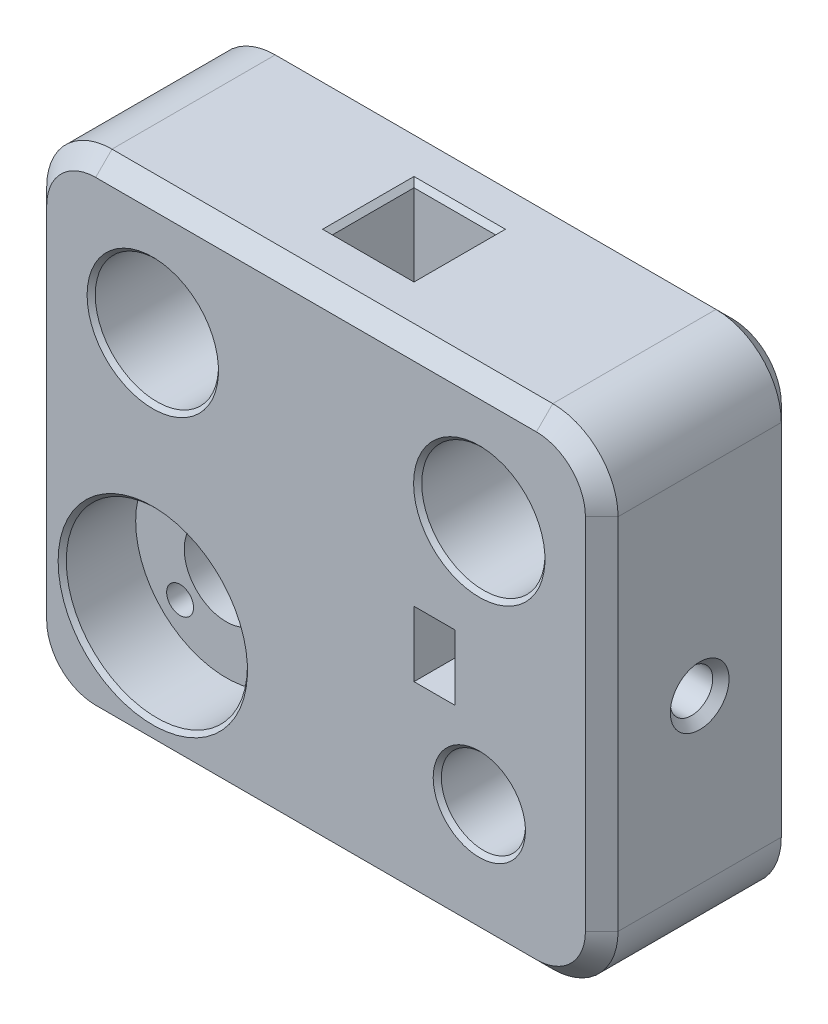
from build123d import *

# Parameters (mm, degrees)
SKETCH1_R               = 7.55
SKETCH1_R_2             = 5.15
BOSS_EXTRUDE1_DEPTH     = 12
SKETCH2_R               = 11.1
CUT_EXTRUDE1_DEPTH      = 9
SKETCH3_R               = 1.65
CUT_EXTRUDE2_DEPTH      = 52.971145841
CUT_EXTRUDE3_DEPTH      = 6
CUT_EXTRUDE4_DEPTH      = 48.634021455
CUT_EXTRUDE4_DEPTH_BACK = 48.634021455
SKETCH5_W               = 10
SKETCH5_H               = 10
CHAMFER1_SIZE           = 2
CHAMFER2_SIZE           = 0.5
SKETCH7_R               = 2.6
CUT_EXTRUDE6_DEPTH      = 33
CUT_EXTRUDE7_DEPTH      = 48.634021455
CUT_EXTRUDE7_DEPTH_BACK = 48.634021455
SKETCH8_W               = 5
SKETCH8_H               = 8
CHAMFER3_SIZE           = 1
CHAMFER4_SIZE           = 0.6
SKETCH9_W               = 2
SKETCH9_H               = 4.3
CUT_EXTRUDE8_DEPTH      = 8


with BuildPart() as part:
    # Sketch1 → Boss-Extrude1 (new, symmetric)
    with BuildSketch(Plane.XY):
        with BuildLine():
            Line((27, -30), (-27, -30))
            ThreePointArc((-27, -30), (-32.656854249, -27.656854249), (-35, -22))
            Line((-35, -22), (-35, 22))
            ThreePointArc((-35, 22), (-32.656854249, 27.656854249), (-27, 30))
            Line((-27, 30), (27, 30))
            ThreePointArc((27, 30), (32.656854249, 27.656854249), (35, 22))
            Line((35, 22), (35, -22))
            ThreePointArc((35, -22), (32.656854249, -27.656854249), (27, -30))
        make_face()
        with Locations((-20, 15)):
            Circle(SKETCH1_R, mode=Mode.SUBTRACT)
        with Locations((20, 15)):
            Circle(SKETCH1_R, mode=Mode.SUBTRACT)
        with Locations((20, -15)):
            Circle(SKETCH1_R_2, mode=Mode.SUBTRACT)
        with Locations((-20, -15)):
            Circle(SKETCH1_R_2, mode=Mode.SUBTRACT)
    extrude(amount=BOSS_EXTRUDE1_DEPTH, both=True)

    # Sketch2 → Cut-Extrude1 (cut)
    with BuildSketch(Plane.XY.offset(12)):
        with Locations((-20, -15)):
            Circle(SKETCH2_R)
    extrude(amount=-CUT_EXTRUDE1_DEPTH, mode=Mode.SUBTRACT)

    # Sketch3 → Cut-Extrude2 (cut, through all)
    with BuildSketch(Plane.XY.offset(12)):
        with Locations((-25.656854249, -9.343145751)):
            Circle(SKETCH3_R)
        with Locations((-14.343145751, -9.343145751)):
            Circle(SKETCH3_R)
        with Locations((-14.343145751, -20.656854249)):
            Circle(SKETCH3_R)
        with Locations((-25.656854249, -20.656854249)):
            Circle(SKETCH3_R)
    extrude(amount=-CUT_EXTRUDE2_DEPTH, mode=Mode.SUBTRACT)

    # Sketch4 → Cut-Extrude3 (cut)
    with BuildSketch(Plane(origin=(0, 0, -12), x_dir=(-1, 0, 0), z_dir=(0, 0, -1))):
        Polygon((17.29883669, -10.135120751), (16.50686169, -7.179429811), (13.55117075, -6.387454811), (11.387454811, -8.55117075), (12.179429811, -11.50686169), (15.135120751, -12.29883669), align=None)
        Polygon((23.49313831, -7.179429811), (22.70116331, -10.135120751), (24.864879249, -12.29883669), (27.820570189, -11.50686169), (28.612545189, -8.55117075), (26.44882925, -6.387454811), align=None)
        Polygon((24.864879249, -17.70116331), (22.70116331, -19.864879249), (23.49313831, -22.820570189), (26.44882925, -23.612545189), (28.612545189, -21.44882925), (27.820570189, -18.49313831), align=None)
        Polygon((15.135120751, -17.70116331), (12.179429811, -18.49313831), (11.387454811, -21.44882925), (13.55117075, -23.612545189), (16.50686169, -22.820570189), (17.29883669, -19.864879249), align=None)
    extrude(amount=-CUT_EXTRUDE3_DEPTH, mode=Mode.SUBTRACT)

    # Sketch5 → Cut-Extrude4 (cut, two sides: drawn at the far end of the back side and taken through both)
    with BuildSketch(Plane(origin=(0, 0, 0), x_dir=(1, 0, 0), z_dir=(0, 1, 0)).offset(-CUT_EXTRUDE4_DEPTH_BACK)):
        Rectangle(SKETCH5_W, SKETCH5_H)
    extrude(amount=CUT_EXTRUDE4_DEPTH + CUT_EXTRUDE4_DEPTH_BACK, mode=Mode.SUBTRACT)

    # Chamfer1
    chamfer1_edges = [part.edges().sort_by_distance(p)[0] for p in [
        (35, 0, -12),
        (32.656854249, -27.656854249, -12),
        (0, -30, -12),
        (-32.656854249, -27.656854249, -12),
        (32.656854249, -27.656854249, 12),
        (35, 0, 12),
        (32.656854249, 27.656854249, 12),
        (0, 30, 12),
        (-32.656854249, 27.656854249, 12),
        (-35, 0, 12),
        (-32.656854249, -27.656854249, 12),
        (-35, 0, -12),
        (0, -30, 12),
        (-32.656854249, 27.656854249, -12),
        (0, 30, -12),
        (32.656854249, 27.656854249, -12),
    ]]
    chamfer(chamfer1_edges, length=CHAMFER1_SIZE)

    # Chamfer2
    chamfer2_edges = [part.edges().sort_by_distance(p)[0] for p in [
        (-27.55, 15, -12),
        (-27.55, 15, 12),
        (12.45, 15, -12),
        (12.45, 15, 12),
        (14.85, -15, -12),
        (14.85, -15, 12),
        (-31.1, -15, 12),
    ]]
    chamfer(chamfer2_edges, length=CHAMFER2_SIZE)

    # Sketch7 → Cut-Extrude6 (cut)
    with BuildSketch(Plane(origin=(35, 0, 0), x_dir=(0, 0, -1), z_dir=(1, 0, 0))):
        with Locations((0, -2)):
            Circle(SKETCH7_R)
    extrude(amount=-CUT_EXTRUDE6_DEPTH, mode=Mode.SUBTRACT)

    # Sketch8 → Cut-Extrude7 (cut, two sides: drawn at the far end of the back side and taken through both)
    with BuildSketch(Plane.XY.offset(-CUT_EXTRUDE7_DEPTH_BACK)):
        with Locations((14.5, -2)):
            Rectangle(SKETCH8_W, SKETCH8_H)
    extrude(amount=CUT_EXTRUDE7_DEPTH + CUT_EXTRUDE7_DEPTH_BACK, mode=Mode.SUBTRACT)

    # Chamfer3
    chamfer3_edges = [part.edges().sort_by_distance(p)[0] for p in [
        (35, -2, 2.6),
    ]]
    chamfer(chamfer3_edges, length=CHAMFER3_SIZE)

    # Chamfer4
    chamfer4_edges = [part.edges().sort_by_distance(p)[0] for p in [
        (-5, -30, 0),
        (0, -30, -5),
        (5, -30, 0),
        (0, -30, 5),
        (-5, 30, 0),
        (0, 30, 5),
        (5, 30, 0),
        (0, 30, -5),
    ]]
    chamfer(chamfer4_edges, length=CHAMFER4_SIZE)

    # Sketch9 → Cut-Extrude8 (cut)
    with BuildSketch(Plane.XZ.offset(30)):
        with Locations((19, -7)):
            Rectangle(SKETCH9_W, SKETCH9_H)
    extrude(amount=-CUT_EXTRUDE8_DEPTH, mode=Mode.SUBTRACT)


solid = part.part
